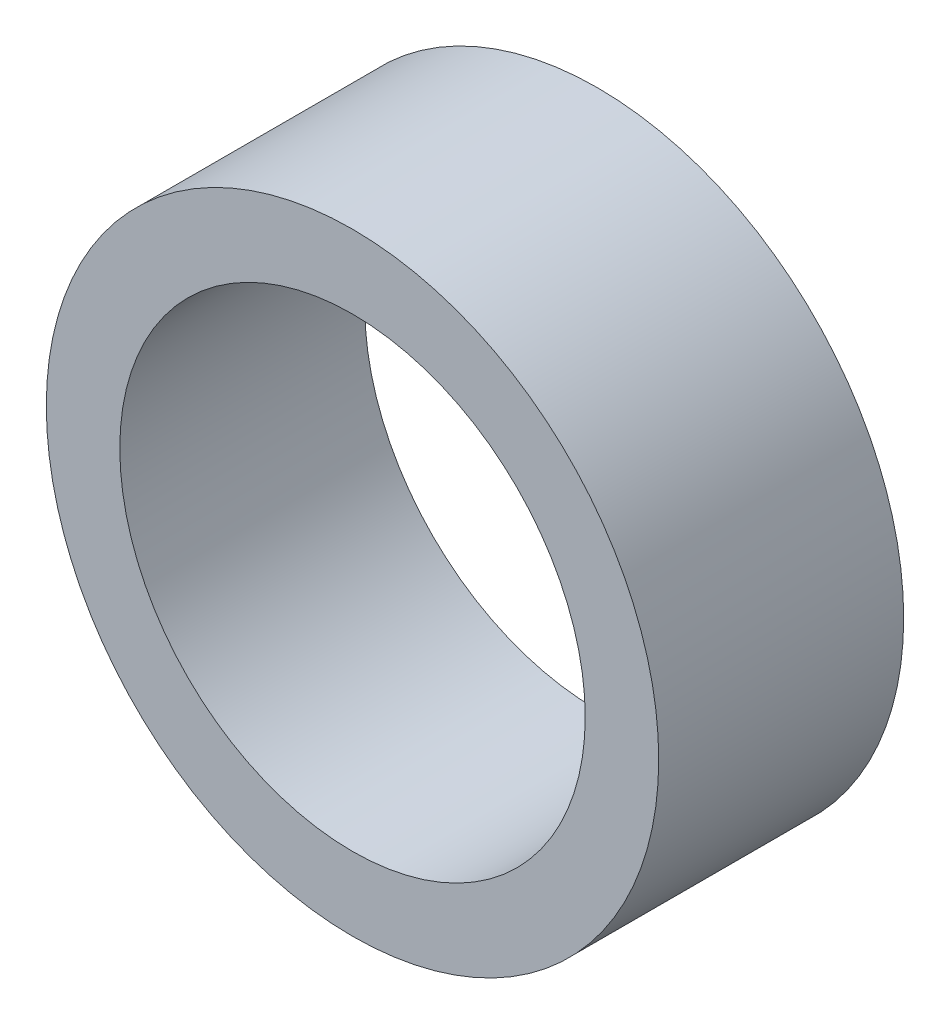
from build123d import *

# Parameters (mm, degrees)
SKETCH1_R           = 12.5
SKETCH1_R_2         = 9.5
BOSS_EXTRUDE1_DEPTH = 10


with BuildPart() as part:
    # Sketch1 → Boss-Extrude1 (new body)
    with BuildSketch(Plane.XY):
        Circle(SKETCH1_R)
        Circle(SKETCH1_R_2, mode=Mode.SUBTRACT)
    extrude(amount=BOSS_EXTRUDE1_DEPTH)


solid = part.part
